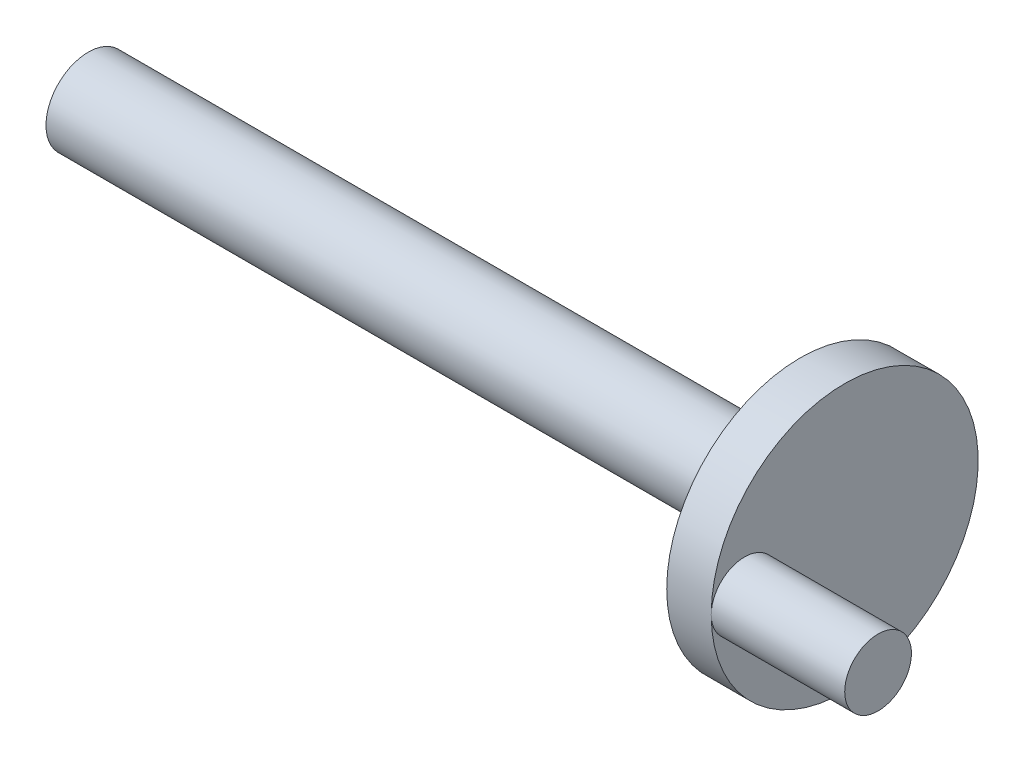
from build123d import *

# Parameters (mm, degrees)
BOSS_EXTRUDE1_DEPTH = 20.32
SKETCH2_R           = 7.62
BOSS_EXTRUDE2_DEPTH = 2.54
SKETCH3_R           = 1.905
BOSS_EXTRUDE3_DEPTH = 7.62


with BuildPart() as part:
    # Sketch1 → Boss-Extrude1 (new, symmetric)
    with BuildSketch(Plane(origin=(0, 0, 0), x_dir=(0, 0, -1), z_dir=(1, 0, 0))):
        with BuildLine():
            Line((1.905, 1.481061781), (1.905, -1.481061781))
            ThreePointArc((1.905, -1.481061781), (-2.413, 0), (1.905, 1.481061781))
        make_face()
    extrude(amount=BOSS_EXTRUDE1_DEPTH, both=True)

    # Sketch2 → Boss-Extrude2 (add)
    with BuildSketch(Plane(origin=(20.32, 0, 0), x_dir=(0, 0, -1), z_dir=(1, 0, 0))):
        Circle(SKETCH2_R)
    extrude(amount=BOSS_EXTRUDE2_DEPTH)

    # Sketch3 → Boss-Extrude3 (add)
    with BuildSketch(Plane(origin=(22.86, 0, 0), x_dir=(0, 0, -1), z_dir=(1, 0, 0))):
        with Locations(Location((-5.715, 0, 0), (0, 0, 179.999322122))):
            Circle(SKETCH3_R)
    extrude(amount=BOSS_EXTRUDE3_DEPTH)


solid = part.part
